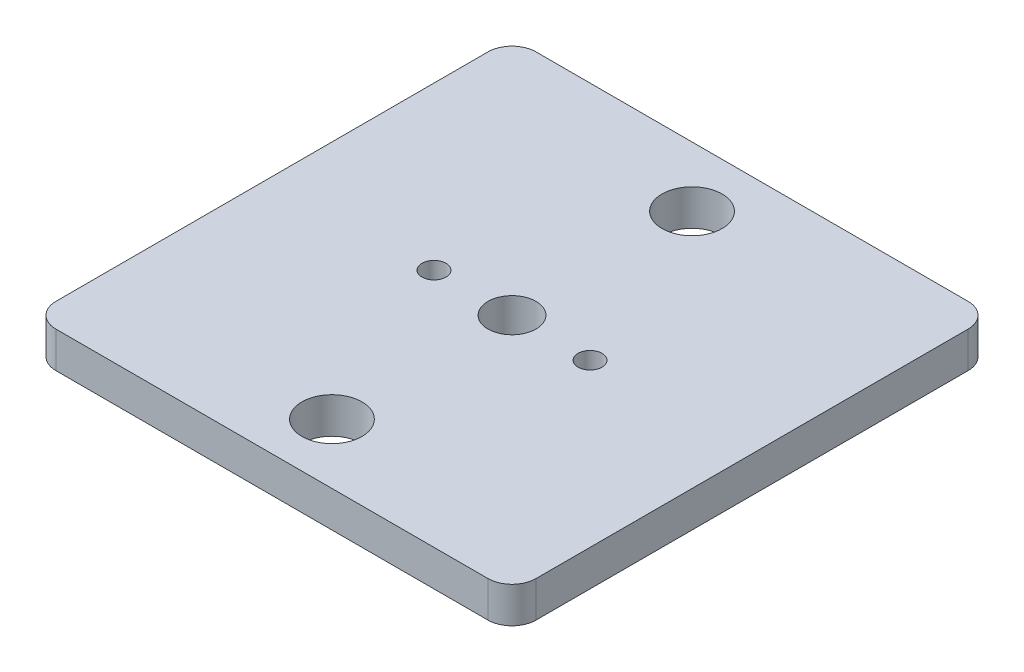
from build123d import *

# Parameters (mm, degrees)
BOSS_EXTRUDE1_DEPTH = 3
SKETCH3_R           = 2
SKETCH3_R_2         = 2.5
CUT_EXTRUDE3_DEPTH  = 29.442925307
SKETCH4_R           = 1
CUT_EXTRUDE4_DEPTH  = 3


with BuildPart() as part:
    # Sketch2 → Boss-Extrude1 (new body)
    with BuildSketch(Plane(origin=(0, 0, 0), x_dir=(1, 0, 0), z_dir=(0, 1, 0))):
        with BuildLine():
            Line((-18, -20), (18, -20))
            ThreePointArc((18, -20), (19.414213562, -19.414213562), (20, -18))
            Line((20, -18), (20, 18))
            ThreePointArc((20, 18), (19.414213562, 19.414213562), (18, 20))
            Line((18, 20), (-18, 20))
            ThreePointArc((-18, 20), (-19.414213562, 19.414213562), (-20, 18))
            Line((-20, 18), (-20, -18))
            ThreePointArc((-20, -18), (-19.414213562, -19.414213562), (-18, -20))
        make_face()
    extrude(amount=BOSS_EXTRUDE1_DEPTH)

    # Sketch3 → Cut-Extrude3 (cut, through all)
    with BuildSketch(Plane(origin=(0, 0, 0), x_dir=(1, 0, 0), z_dir=(0, 1, 0))):
        with Locations(Location((0, 0, 0), (0, 0, 270))):
            Circle(SKETCH3_R)
        with Locations(Location((0, 15, 0), (0, 0, 270))):
            Circle(SKETCH3_R_2)
        with Locations(Location((0, -15, 0), (0, 0, 270))):
            Circle(SKETCH3_R_2)
    extrude(amount=CUT_EXTRUDE3_DEPTH, mode=Mode.SUBTRACT)

    # Sketch4 → Cut-Extrude4 (cut)
    with BuildSketch(Plane(origin=(0, 0, 0), x_dir=(1, 0, 0), z_dir=(0, 1, 0))):
        with Locations(Location((6.5, 0, 0), (0, 0, 270))):
            Circle(SKETCH4_R)
        with Locations(Location((-6.5, 0, 0), (0, 0, 270))):
            Circle(SKETCH4_R)
    extrude(amount=CUT_EXTRUDE4_DEPTH, mode=Mode.SUBTRACT)


solid = part.part
